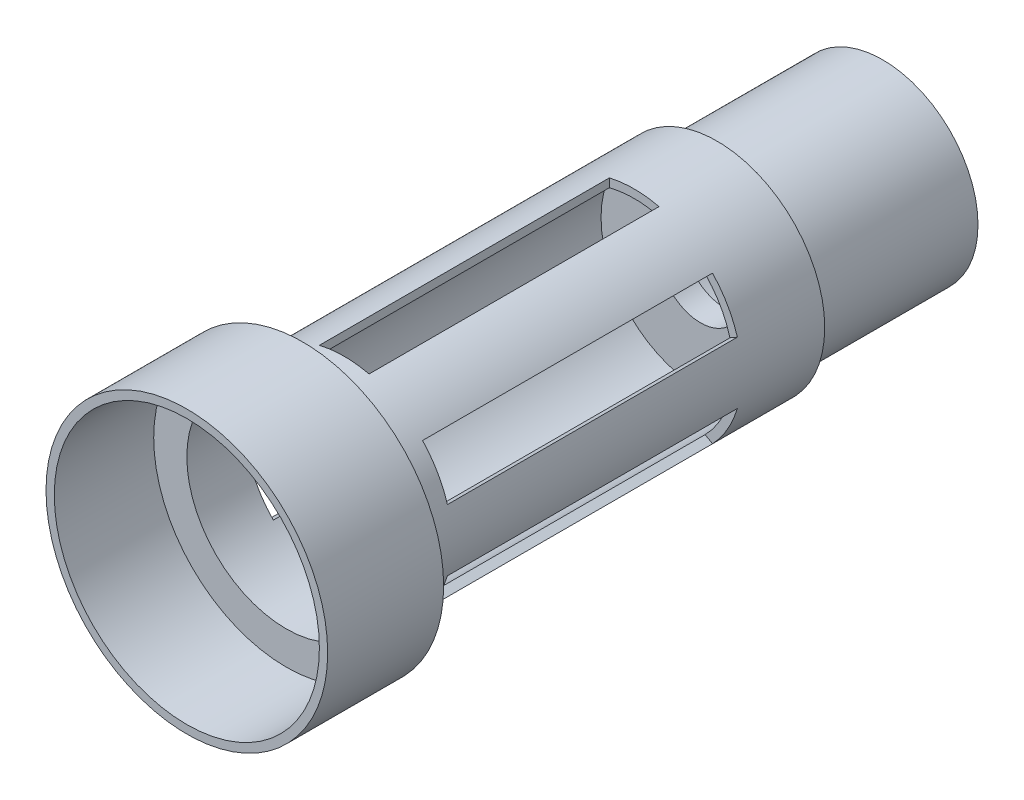
from build123d import *

# Parameters (mm, degrees)
SKETCH1_R           = 14.605
BOSS_EXTRUDE1_DEPTH = 25.4
SKETCH2_R           = 16.51
BOSS_EXTRUDE2_DEPTH = 63.5
SKETCH5_R           = 13.462
CUT_EXTRUDE1_DEPTH  = 24.13
SKETCH6_R           = 15.24
CUT_EXTRUDE3_DEPTH  = 60.96
CUT_EXTRUDE4_REACH  = 67.278
SKETCH7_R           = 6.35
SKETCH9_W           = 7.62
SKETCH9_H           = 44.45
CUT_EXTRUDE5_DEPTH  = 92.915016183
CIRPATTERN1_COUNT   = 3
SKETCH10_R          = 20.32
SKETCH10_R_2        = 15.24
BOSS_EXTRUDE3_DEPTH = 2.54
SKETCH11_R          = 21.59
SKETCH11_R_2        = 20.32
BOSS_EXTRUDE4_DEPTH = 15.24
SKETCH12_R          = 21.59
SKETCH12_R_2        = 20.32
BOSS_EXTRUDE5_DEPTH = 2.54


with BuildPart() as part:
    # Sketch1 → Boss-Extrude1 (new body)
    with BuildSketch(Plane.XY):
        Circle(SKETCH1_R)
    extrude(amount=BOSS_EXTRUDE1_DEPTH)

    # Sketch2 → Boss-Extrude2 (add)
    with BuildSketch(Plane.XY.offset(25.4)):
        Circle(SKETCH2_R)
    extrude(amount=BOSS_EXTRUDE2_DEPTH)

    # Sketch5 → Cut-Extrude1 (cut)
    with BuildSketch(Plane(origin=(0, 0, 0), x_dir=(-1, 0, 0), z_dir=(0, 0, -1))):
        Circle(SKETCH5_R)
    extrude(amount=-CUT_EXTRUDE1_DEPTH, mode=Mode.SUBTRACT)

    # Sketch6 → Cut-Extrude3 (cut)
    with BuildSketch(Plane.XY.offset(88.9)):
        Circle(SKETCH6_R)
    extrude(amount=-CUT_EXTRUDE3_DEPTH, mode=Mode.SUBTRACT)

    # Sketch7 → Cut-Extrude4 (cut, up to next)
    with BuildSketch(Plane.XY.offset(27.94), mode=Mode.PRIVATE) as cut_extrude4_sk1:
        Circle(SKETCH7_R)
    cut_extrude4_tool1 = extrude(cut_extrude4_sk1.sketch, amount=-CUT_EXTRUDE4_REACH, mode=Mode.PRIVATE) & part.part
    add(cut_extrude4_tool1.solids().sort_by_distance((0, 0, 27.94))[0], mode=Mode.SUBTRACT)

    # Sketch9 → Cut-Extrude5 (cut, symmetric)
    with BuildSketch(Plane(origin=(0, 0, 0), x_dir=(1, 0, 0), z_dir=(0, 1, 0))):
        with Locations((0, -60.325)):
            Rectangle(SKETCH9_W, SKETCH9_H)
    cut_extrude5 = extrude(amount=CUT_EXTRUDE5_DEPTH, both=True, mode=Mode.SUBTRACT)

    # CirPattern1: Cut-Extrude5 ×3 about axis
    cirpattern1_axis = Axis((0, 0, 0), (0, 0, 1))
    for i in range(1, CIRPATTERN1_COUNT):
        add(cut_extrude5.rotate(cirpattern1_axis, i * 360 / CIRPATTERN1_COUNT), mode=Mode.SUBTRACT)



with BuildPart() as body_2:
    # Sketch10 → Boss-Extrude3 (new body)
    with BuildSketch(Plane.XY.offset(88.9)):
        Circle(SKETCH10_R)
        Circle(SKETCH10_R_2, mode=Mode.SUBTRACT)
    extrude(amount=BOSS_EXTRUDE3_DEPTH)


with BuildPart() as body_3:
    # Sketch11 → Boss-Extrude4 (new body)
    with BuildSketch(Plane.XY.offset(91.44)):
        with Locations(Location((0, 0, 0), (0, 0, 180))):
            Circle(SKETCH11_R)
        with Locations(Location((0, 0, 0), (0, 0, 180))):
            Circle(SKETCH11_R_2, mode=Mode.SUBTRACT)
    extrude(amount=BOSS_EXTRUDE4_DEPTH)


with BuildPart() as part_1:
    add(part.part)

    add(body_2.part)  # Boss-Extrude5 merges body 2

    add(body_3.part)  # Boss-Extrude5 merges body 3
    # Sketch12 → Boss-Extrude5 (add)
    with BuildSketch(Plane(origin=(0, 0, 91.44), x_dir=(-1, 0, 0), z_dir=(0, 0, -1))):
        with Locations(Location((0, 0, 0), (0, 0, 180))):
            Circle(SKETCH12_R)
        Circle(SKETCH12_R_2, mode=Mode.SUBTRACT)
    extrude(amount=BOSS_EXTRUDE5_DEPTH)


solid = part_1.part
